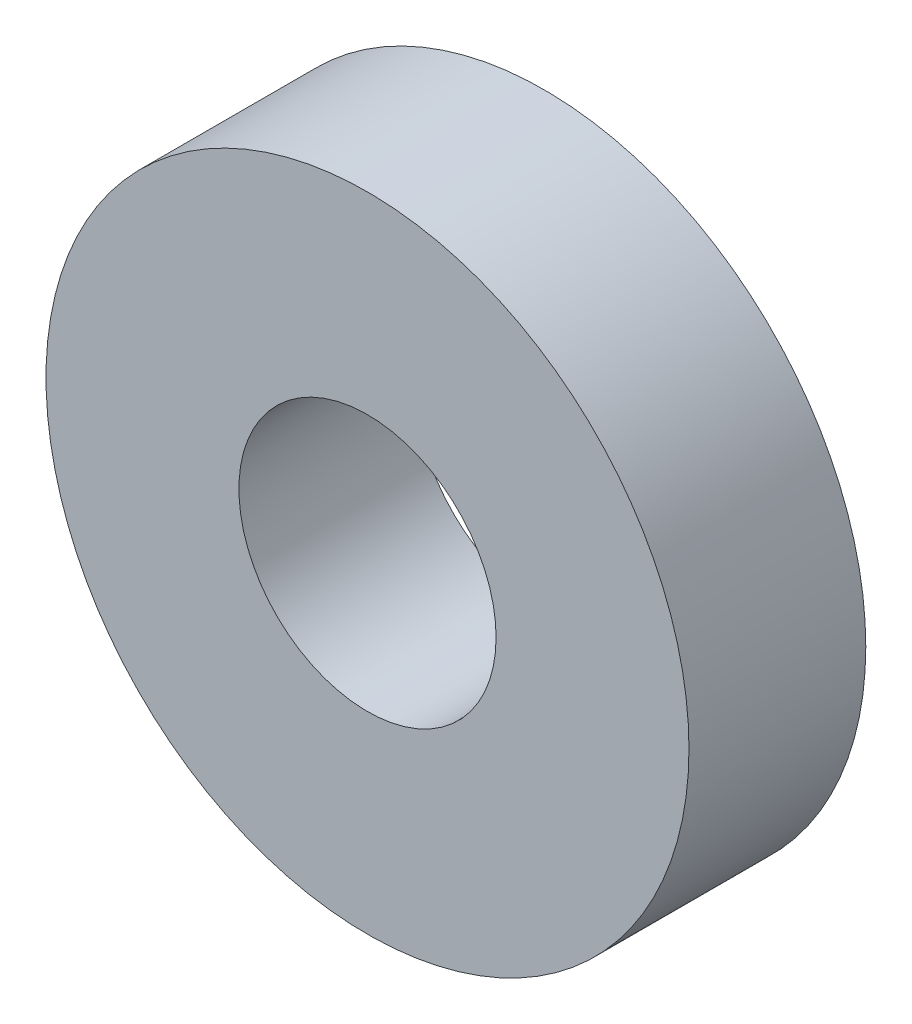
from build123d import *

# Parameters (mm, degrees)
SKETCH1_R           = 10
SKETCH1_R_2         = 4
BOSS_EXTRUDE1_DEPTH = 5.5


with BuildPart() as part:
    # Sketch1 → Boss-Extrude1 (new body)
    with BuildSketch(Plane.XY):
        Circle(SKETCH1_R)
        Circle(SKETCH1_R_2, mode=Mode.SUBTRACT)
    extrude(amount=BOSS_EXTRUDE1_DEPTH)


solid = part.part
